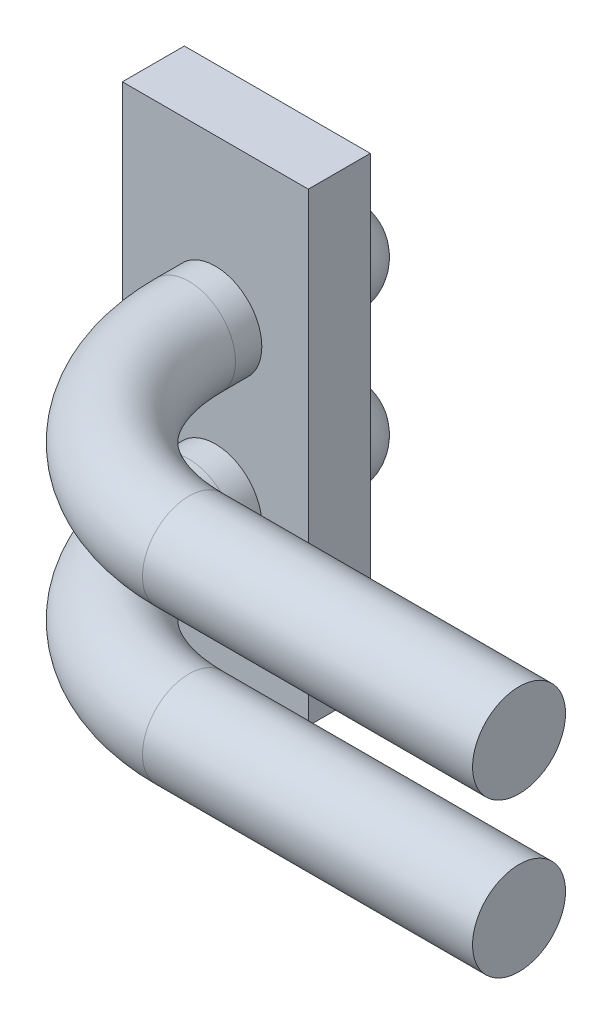
from build123d import *

# Parameters (mm, degrees)
SKETCH1_W           = 6
SKETCH1_H           = 15
BOSS_EXTRUDE1_DEPTH = 2
SKETCH2_R           = 1.5
BOSS_EXTRUDE2_DEPTH = 3
FILLET1_R           = 1.5
SKETCH3_R           = 1.5


with BuildPart() as part:
    # Sketch1 → Boss-Extrude1 (new body)
    with BuildSketch(Plane.XY):
        Rectangle(SKETCH1_W, SKETCH1_H)
    extrude(amount=BOSS_EXTRUDE1_DEPTH)

    # Sketch2 → Boss-Extrude2 (add)
    with BuildSketch(Plane(origin=(0, 0, 0), x_dir=(-1, 0, 0), z_dir=(0, 0, -1))):
        with Locations((0, 2.35)):
            Circle(SKETCH2_R)
        with Locations((0, -2.62)):
            Circle(SKETCH2_R)
    extrude(amount=BOSS_EXTRUDE2_DEPTH)

    # Fillet1
    fillet1_edges = [part.edges().sort_by_distance(p)[0] for p in [
        (1.5, 2.35, -3),
        (1.5, -2.62, -3),
    ]]
    fillet(fillet1_edges, radius=FILLET1_R)

    # Sweep1: sweep along a path in Sketch4
    with BuildLine(Plane(origin=(0, 2.35, 0), x_dir=(-1, 0, 0), z_dir=(0, 1, 0))) as sweep1_path:
        Line((0, 2), (0, 2.85))
        ThreePointArc((0, 2.85), (-1.757359313, 7.092640687), (-6, 8.85))
        Line((-6, 8.85), (-16.65, 8.85))
    # Sketch3 → Sweep1 (sweep)
    with BuildSketch(Plane.XY.offset(2)):
        with Locations((0, -2.62)):
            Circle(SKETCH3_R)
        with Locations((0, 2.35)):
            Circle(SKETCH3_R)
    sweep(path=sweep1_path.line)


solid = part.part
